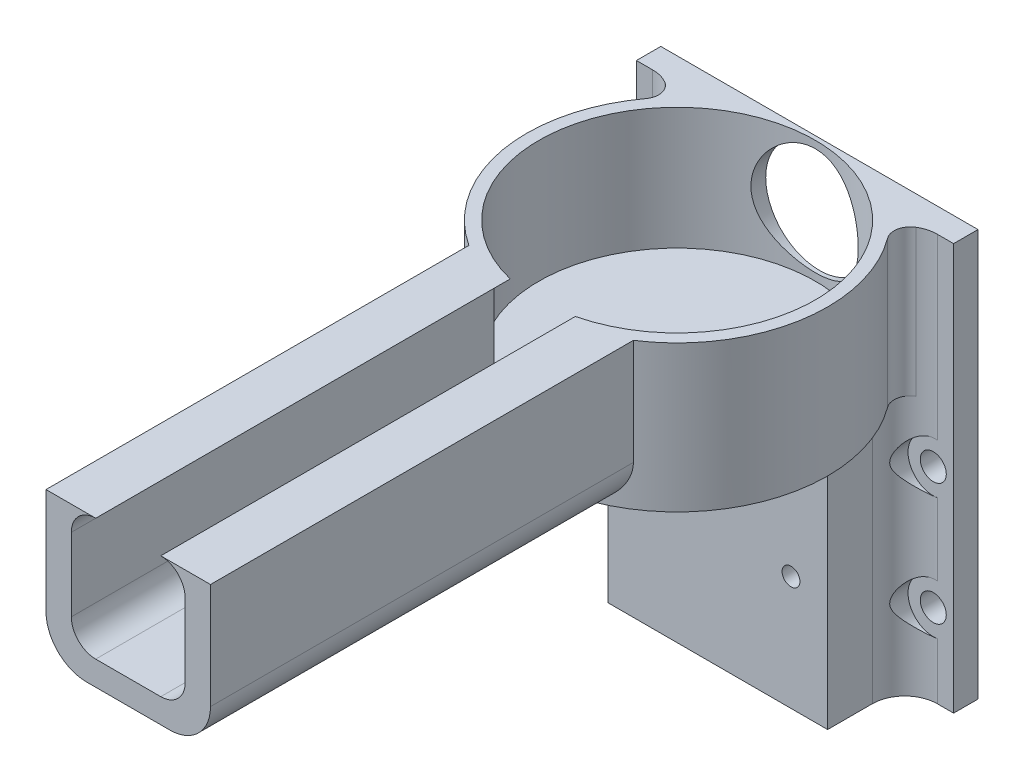
from build123d import *

# Parameters (mm, degrees)
SKETCH1_R                 = 18.5
SKETCH1_R_2               = 17
BOSS_EXTRUDE1_DEPTH       = 15
BOSS_EXTRUDE2_START       = 3
SKETCH2_R                 = 18.5
BOSS_EXTRUDE2_DEPTH       = 3
CUT_EXTRUDE1_REACH        = 33.757
SKETCH3_R                 = 3.25
CUT_EXTRUDE2_REACH        = 33.757
BOSS_EXTRUDE5_DEPTH       = 2
BOSS_EXTRUDE6_START       = 32
BOSS_EXTRUDE6_DEPTH       = 32
CUT_EXTRUDE3_REACH        = 47.532
SKETCH10_R                = 1.1
BOSS_EXTRUDE7_DEPTH       = 18
SKETCH12_W                = 6
SKETCH12_H                = 3
BOSS_EXTRUDE8_DEPTH       = 50
FILLET1_R                 = 4
CUT_EXTRUDE4_DEPTH        = 54.189481424
CUT_EXTRUDE4_DEPTH_BACK   = 54.189481424
SKETCH13_R                = 1.6
CUT_EXTRUDE5_DEPTH        = 46.947111709
CUT_EXTRUDE5_DEPTH_BACK   = 9.491933
SKETCH14_R                = 3.1
FILLET2_R                 = 2
BOSS_EXTRUDE9_DEPTH       = 50
FILLET3_R                 = 5
FILLET4_R                 = 3
BOSS_EXTRUDE10_REACH      = 95.955
BOSS_EXTRUDE10_END_RADIUS = 17
BOSS_EXTRUDE11_REACH      = 95.955
BOSS_EXTRUDE11_END_RADIUS = 17
SKETCH19_W                = 14
SKETCH19_H                = 15
SKETCH19_R                = 6.6


with BuildPart() as part:
    # Sketch1 → Boss-Extrude1 (new body)
    with BuildSketch(Plane(origin=(0, 0, 0), x_dir=(1, 0, 0), z_dir=(0, 1, 0))):
        with Locations(Location((0, 0, 0), (0, 0, 270))):
            Circle(SKETCH1_R)
        with Locations(Location((0, 0, 0), (0, 0, 270))):
            Circle(SKETCH1_R_2, mode=Mode.SUBTRACT)
    extrude(amount=BOSS_EXTRUDE1_DEPTH)

    # Sketch2 → Boss-Extrude2 (add)
    with BuildSketch(Plane.XZ.offset(BOSS_EXTRUDE2_START)):
        with Locations(Location((0, 0, 0), (0, 0, 270))):
            Circle(SKETCH2_R)
    extrude(amount=-BOSS_EXTRUDE2_DEPTH)

    # Sketch3 → Cut-Extrude1 (cut, up to next)
    with BuildSketch(Plane.XZ.offset(3), mode=Mode.PRIVATE) as cut_extrude1_sk1:
        with Locations(Location((0, 0, 0), (0, 0, 270))):
            Circle(SKETCH3_R)
    cut_extrude1_tool1 = extrude(cut_extrude1_sk1.sketch, amount=-CUT_EXTRUDE1_REACH, mode=Mode.PRIVATE) & part.part
    add(cut_extrude1_tool1.solids().sort_by_distance((0, -3, 0))[0], mode=Mode.SUBTRACT)

    # Sketch4 → Cut-Extrude2 (cut, up to next)
    with BuildSketch(Plane.XZ.offset(3), mode=Mode.PRIVATE) as cut_extrude2_sk1:
        with BuildLine():
            Line((-7, 15.491933385), (7, 15.491933385))
            Line((7, 15.491933385), (10.111874208, 15.491933385))
            ThreePointArc((10.111874208, 15.491933385), (0, 18.5), (-10.111874208, 15.491933385))
            Line((-10.111874208, 15.491933385), (-7, 15.491933385))
        make_face()
    cut_extrude2_tool1 = extrude(cut_extrude2_sk1.sketch, amount=-CUT_EXTRUDE2_REACH, mode=Mode.PRIVATE) & part.part
    cut_extrude2 = cut_extrude2_tool1.solids().sort_by_distance((0, -3, 16.70396))[0]
    add(cut_extrude2, mode=Mode.SUBTRACT)

    # Sketch7 → Boss-Extrude5 (add)
    with BuildSketch(Plane.XY.offset(15.491933385)):
        Polygon((-10.111874208, 15), (-10.111874208, -3), (10.111874208, -3), (10.111874208, 15), (7, 15), (7, 0), (-7, 0), (-7, 15), align=None)
    boss_extrude5 = extrude(amount=BOSS_EXTRUDE5_DEPTH)

    # Mirror1: Cut-Extrude2, Boss-Extrude5 across plane
    add(cut_extrude2.mirror(Plane.XY), mode=Mode.SUBTRACT)
    add(boss_extrude5.mirror(Plane.XY))

    # Sketch8 → Boss-Extrude6 (add)
    with BuildSketch(Plane.XZ.offset(3).offset(BOSS_EXTRUDE6_START)):
        with BuildLine():
            Line((0, -5), (-13.5, -5))
            Line((-13.5, -5), (-13.5, -12.649110641))
            ThreePointArc((-13.5, -12.649110641), (-12.770060789, -13.385647069), (-12, -14.08012784))
            Line((-12, -14.08012784), (-12, -7))
            Line((-12, -7), (0, -7))
            Line((0, -7), (0, -5))
        make_face()
        with BuildLine():
            ThreePointArc((-12, -14.08012784), (-12.770060789, -13.385647069), (-13.5, -12.649110641))
            Line((-13.5, -12.649110641), (-13.5, -17.491933385))
            Line((-13.5, -17.491933385), (-12, -17.491933385))
            Line((-12, -17.491933385), (-12, -14.08012784))
        make_face()
        with BuildLine():
            Line((13.5, -5), (0, -5))
            Line((0, -5), (0, -7))
            Line((0, -7), (12, -7))
            Line((12, -7), (12, -14.08012784))
            ThreePointArc((12, -14.08012784), (12.770060789, -13.385647069), (13.5, -12.649110641))
            Line((13.5, -12.649110641), (13.5, -5))
        make_face()
        with BuildLine():
            Line((13.5, -17.491933385), (13.5, -12.649110641))
            ThreePointArc((13.5, -12.649110641), (12.770060789, -13.385647069), (12, -14.08012784))
            Line((12, -14.08012784), (12, -17.491933385))
            Line((12, -17.491933385), (13.5, -17.491933385))
        make_face()
    extrude(amount=-BOSS_EXTRUDE6_DEPTH)

    # Sketch10 → Cut-Extrude3 (cut, up to next)
    with BuildSketch(Plane.XY.offset(-5), mode=Mode.PRIVATE) as cut_extrude3_sk1:
        with Locations((-9, -20.95)):
            Circle(SKETCH10_R)
    cut_extrude3_tool1 = extrude(cut_extrude3_sk1.sketch, amount=-CUT_EXTRUDE3_REACH, mode=Mode.PRIVATE) & part.part
    # Sketch10 → Cut-Extrude3 (cut, up to next)
    with BuildSketch(Plane.XY.offset(-5), mode=Mode.PRIVATE) as cut_extrude3_sk2:
        with Locations((9, -20.95)):
            Circle(SKETCH10_R)
    cut_extrude3_tool2 = extrude(cut_extrude3_sk2.sketch, amount=-CUT_EXTRUDE3_REACH, mode=Mode.PRIVATE) & part.part
    add(cut_extrude3_tool1.solids().sort_by_distance((-9, -20.95, -5))[0], mode=Mode.SUBTRACT)
    add(cut_extrude3_tool2.solids().sort_by_distance((9, -20.95, -5))[0], mode=Mode.SUBTRACT)

    # Sketch11 → Boss-Extrude7 (add)
    with BuildSketch(Plane(origin=(0, 15, 0), x_dir=(1, 0, 0), z_dir=(0, 1, 0))):
        Polygon((-13.5, 17.491933385), (-7, 17.491933385), (-13.5, 12.649110641), align=None)
        Polygon((7, 17.491933385), (13.5, 17.491933385), (13.5, 12.649110641), align=None)
    extrude(amount=-BOSS_EXTRUDE7_DEPTH)

    # Sketch12 → Boss-Extrude8 (add)
    with BuildSketch(Plane.XZ.offset(35)):
        with Locations((16.5, -15.991933385)):
            Rectangle(SKETCH12_W, SKETCH12_H)
        with Locations((-16.5, -15.991933385)):
            Rectangle(SKETCH12_W, SKETCH12_H)
    extrude(amount=-BOSS_EXTRUDE8_DEPTH)

    # Fillet1
    fillet1_edges = [part.edges().sort_by_distance(p)[0] for p in [
        (13.5, -10, -14.491933385),
        (-13.5, -10, -14.491933385),
    ]]
    fillet(fillet1_edges, radius=FILLET1_R)

    # Sketch13 → Cut-Extrude4 (cut, two sides: drawn at the far end of the back side and taken through both)
    with BuildSketch(Plane(origin=(0, 0, -17.491933385), x_dir=(-1, 0, 0), z_dir=(0, 0, -1)).offset(-CUT_EXTRUDE4_DEPTH_BACK)):
        with Locations((-17, -10)):
            Circle(SKETCH13_R)
        with Locations((-17, -25)):
            Circle(SKETCH13_R)
        with Locations((17, -25)):
            Circle(SKETCH13_R)
        with Locations((17, -10)):
            Circle(SKETCH13_R)
    extrude(amount=CUT_EXTRUDE4_DEPTH + CUT_EXTRUDE4_DEPTH_BACK, mode=Mode.SUBTRACT)

    # Sketch14 → Cut-Extrude5 (cut, two sides: drawn at the far end of the back side and taken through both)
    with BuildSketch(Plane.XY.offset(-5).offset(-CUT_EXTRUDE5_DEPTH_BACK)):
        with Locations((-17, -10)):
            Circle(SKETCH14_R)
        with Locations((17, -10)):
            Circle(SKETCH14_R)
        with Locations((17, -25)):
            Circle(SKETCH14_R)
        with Locations((-17, -25)):
            Circle(SKETCH14_R)
    extrude(amount=CUT_EXTRUDE5_DEPTH + CUT_EXTRUDE5_DEPTH_BACK, mode=Mode.SUBTRACT)

    # Fillet2
    fillet2_edges = [part.edges().sort_by_distance(p)[0] for p in [
        (-13.891510102, 6, -12.21785362),
        (13.891510102, 6, -12.21785362),
    ]]
    fillet(fillet2_edges, radius=FILLET2_R)

    # Sketch17 → Boss-Extrude9 (add)
    with BuildSketch(Plane.XY.offset(17.491933385)):
        Polygon((-7, 15), (-10.111874208, 15), (-10.111874208, -3), (10.111874208, -3), (10.111874208, 15), (7, 15), (7, 0), (-7, 0), align=None)
    extrude(amount=BOSS_EXTRUDE9_DEPTH)

    # Fillet3
    fillet3_edges = [part.edges().sort_by_distance(p)[0] for p in [
        (-10.111874208, -3, 41.491933385),
        (10.111874208, -3, 41.491933385),
    ]]
    fillet(fillet3_edges, radius=FILLET3_R)

    # Fillet4
    fillet4_edges = [part.edges().sort_by_distance(p)[0] for p in [
        (7, 0, 41.491933385),
        (-7, 0, 41.491933385),
    ]]
    fillet(fillet4_edges, radius=FILLET4_R)

    # Boss-Extrude10: up to this cylinder (the profile starts outside it)
    boss_extrude10_end = Plane(origin=(0, 14.329896, 0), z_dir=(0, -1, 0)) * Cylinder(BOSS_EXTRUDE10_END_RADIUS, 226.91, mode=Mode.PRIVATE)
    # Sketch18 → Boss-Extrude10 (add, up to the surface)
    with BuildSketch(Plane.XY.offset(67.491933385), mode=Mode.PRIVATE) as boss_extrude10_sk1:
        with BuildLine():
            Line((-4, 15), (-7, 15))
            Line((-7, 15), (-7, 12))
            ThreePointArc((-7, 12), (-6.121320344, 14.121320344), (-4, 15))
        make_face()
    boss_extrude10_tool1 = extrude(boss_extrude10_sk1.sketch, amount=-BOSS_EXTRUDE10_REACH, mode=Mode.PRIVATE) - boss_extrude10_end
    boss_extrude10 = boss_extrude10_tool1.solids().sort_by_distance((-6.329896, 14.329896, 67.491933))[0]
    add(boss_extrude10)

    # Mirror9: Boss-Extrude10 across plane
    add(boss_extrude10.mirror(Plane(origin=(0, 0, 0), x_dir=(0, 0, 1), z_dir=(1, 0, 0))))

    # Boss-Extrude11: up to this cylinder (the profile starts outside it)
    boss_extrude11_end = Plane(origin=(0, 14.794817, 0), z_dir=(0, -1, 0)) * Cylinder(BOSS_EXTRUDE11_END_RADIUS, 226.91, mode=Mode.PRIVATE)
    # Sketch19 → Boss-Extrude11 (add, up to the surface)
    with BuildSketch(Plane(origin=(0, 0, -17.491933385), x_dir=(-1, 0, 0), z_dir=(0, 0, -1)), mode=Mode.PRIVATE) as boss_extrude11_sk1:
        with Locations((0, 7.5)):
            Rectangle(SKETCH19_W, SKETCH19_H)
        with Locations((0, 7.5)):
            Circle(SKETCH19_R, mode=Mode.SUBTRACT)
    boss_extrude11_tool1 = extrude(boss_extrude11_sk1.sketch, amount=-BOSS_EXTRUDE11_REACH, mode=Mode.PRIVATE) - boss_extrude11_end
    add(boss_extrude11_tool1.solids().sort_by_distance((0, 14.794817, -17.491933))[0])


solid = part.part
